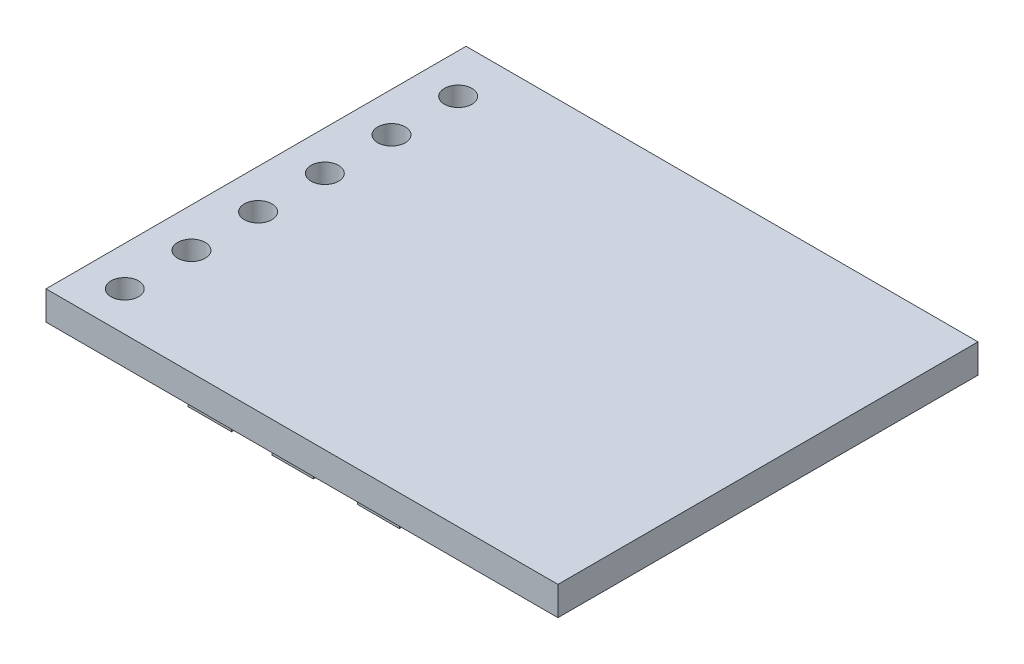
from build123d import *

# Parameters (mm, degrees)
SKETCH1_W               = 19.5
SKETCH1_H               = 16
PCB_DEPTH               = 1.1
HOLES_REACH             = 14.66
SKETCH2_R               = 0.525
SKETCH3_W               = 6.970626183
SKETCH3_H               = 7.047226471
SKETCH3_W_2             = 3.232532143
SKETCH3_H_2             = 1.853726963
SKETCH3_W_3             = 1.608606043
SKETCH3_H_3             = 0.674082532
SKETCH3_H_4             = 0.766002877
SKETCH3_W_4             = 3.140611797
SKETCH3_H_5             = 1.470725524
SKETCH3_W_5             = 0.949843568
SKETCH3_H_6             = 1.363485122
SKETCH3_W_6             = 0.919203453
SKETCH3_W_7             = 1.593285985
SKETCH3_H_7             = 0.827283108
SKETCH3_W_8             = 1.577965927
SKETCH3_W_9             = 1.669886272
SKETCH3_W_10            = 1.041763914
SKETCH3_H_8             = 1.516685697
SKETCH3_W_11            = 0.93452351
BOTTOM_COMPONENTS_DEPTH = 1.05


with BuildPart() as part:
    # Sketch1 → PCB (new body)
    with BuildSketch(Plane(origin=(0, 0, 0), x_dir=(1, 0, 0), z_dir=(0, 1, 0))):
        Rectangle(SKETCH1_W, SKETCH1_H)
    extrude(amount=PCB_DEPTH)

    # Sketch2 → Holes (cut, up to next)
    with BuildSketch(Plane(origin=(0, 1.1, 0), x_dir=(1, 0, 0), z_dir=(0, 1, 0)), mode=Mode.PRIVATE) as holes_sk1:
        with Locations(Location((-8.25, -6.5, 0), (0, 0, 270))):
            Circle(SKETCH2_R)
    holes_tool1 = extrude(holes_sk1.sketch, amount=-HOLES_REACH, mode=Mode.PRIVATE) & part.part
    # Sketch2 → Holes (cut, up to next)
    with BuildSketch(Plane(origin=(0, 1.1, 0), x_dir=(1, 0, 0), z_dir=(0, 1, 0)), mode=Mode.PRIVATE) as holes_sk2:
        with Locations(Location((-8.25, -3.96, 0), (0, 0, 270))):
            Circle(SKETCH2_R)
    holes_tool2 = extrude(holes_sk2.sketch, amount=-HOLES_REACH, mode=Mode.PRIVATE) & part.part
    # Sketch2 → Holes (cut, up to next)
    with BuildSketch(Plane(origin=(0, 1.1, 0), x_dir=(1, 0, 0), z_dir=(0, 1, 0)), mode=Mode.PRIVATE) as holes_sk3:
        with Locations(Location((-8.25, -1.42, 0), (0, 0, 270))):
            Circle(SKETCH2_R)
    holes_tool3 = extrude(holes_sk3.sketch, amount=-HOLES_REACH, mode=Mode.PRIVATE) & part.part
    # Sketch2 → Holes (cut, up to next)
    with BuildSketch(Plane(origin=(0, 1.1, 0), x_dir=(1, 0, 0), z_dir=(0, 1, 0)), mode=Mode.PRIVATE) as holes_sk4:
        with Locations(Location((-8.25, 1.12, 0), (0, 0, 270))):
            Circle(SKETCH2_R)
    holes_tool4 = extrude(holes_sk4.sketch, amount=-HOLES_REACH, mode=Mode.PRIVATE) & part.part
    # Sketch2 → Holes (cut, up to next)
    with BuildSketch(Plane(origin=(0, 1.1, 0), x_dir=(1, 0, 0), z_dir=(0, 1, 0)), mode=Mode.PRIVATE) as holes_sk5:
        with Locations(Location((-8.25, 3.66, 0), (0, 0, 270))):
            Circle(SKETCH2_R)
    holes_tool5 = extrude(holes_sk5.sketch, amount=-HOLES_REACH, mode=Mode.PRIVATE) & part.part
    # Sketch2 → Holes (cut, up to next)
    with BuildSketch(Plane(origin=(0, 1.1, 0), x_dir=(1, 0, 0), z_dir=(0, 1, 0)), mode=Mode.PRIVATE) as holes_sk6:
        with Locations(Location((-8.25, 6.2, 0), (0, 0, 270))):
            Circle(SKETCH2_R)
    holes_tool6 = extrude(holes_sk6.sketch, amount=-HOLES_REACH, mode=Mode.PRIVATE) & part.part
    add(holes_tool1.solids().sort_by_distance((-8.25, 1.1, 6.5))[0], mode=Mode.SUBTRACT)
    add(holes_tool2.solids().sort_by_distance((-8.25, 1.1, 3.96))[0], mode=Mode.SUBTRACT)
    add(holes_tool3.solids().sort_by_distance((-8.25, 1.1, 1.42))[0], mode=Mode.SUBTRACT)
    add(holes_tool4.solids().sort_by_distance((-8.25, 1.1, -1.12))[0], mode=Mode.SUBTRACT)
    add(holes_tool5.solids().sort_by_distance((-8.25, 1.1, -3.66))[0], mode=Mode.SUBTRACT)
    add(holes_tool6.solids().sort_by_distance((-8.25, 1.1, -6.2))[0], mode=Mode.SUBTRACT)

    # Sketch3 → Bottom components (add)
    with BuildSketch(Plane.XZ):
        with Locations((0.666422503, 0.628122359)):
            Rectangle(SKETCH3_W, SKETCH3_H)
        with Locations((-4.43515666, -5.18583948)):
            Rectangle(SKETCH3_W_2, SKETCH3_H_2)
        with Locations((-1.034103885, -5.300739911)):
            Rectangle(SKETCH3_W_3, SKETCH3_H_3)
        with Locations((-1.034103885, -6.265903537)):
            Rectangle(SKETCH3_W_3, SKETCH3_H_4)
        with Locations((2.382268949, -6.235263421)):
            Rectangle(SKETCH3_W_4, SKETCH3_H_5)
        with Locations((4.948378587, 5.967162414)):
            Rectangle(SKETCH3_W_5, SKETCH3_H_6)
        with Locations((6.265903537, 5.967162414)):
            Rectangle(SKETCH3_W_6, SKETCH3_H_6)
        with Locations((1.945647309, 6.61826486)):
            Rectangle(SKETCH3_W_7, SKETCH3_H_7)
        with Locations((-1.325184978, 6.61826486)):
            Rectangle(SKETCH3_W_8, SKETCH3_H_7)
        with Locations((-4.481116832, 6.61826486)):
            Rectangle(SKETCH3_W_9, SKETCH3_H_7)
        with Locations((4.99433876, -5.722041494)):
            Rectangle(SKETCH3_W_10, SKETCH3_H_8)
        with Locations((6.411444083, -5.722041494)):
            Rectangle(SKETCH3_W_11, SKETCH3_H_8)
    extrude(amount=BOTTOM_COMPONENTS_DEPTH)


solid = part.part
